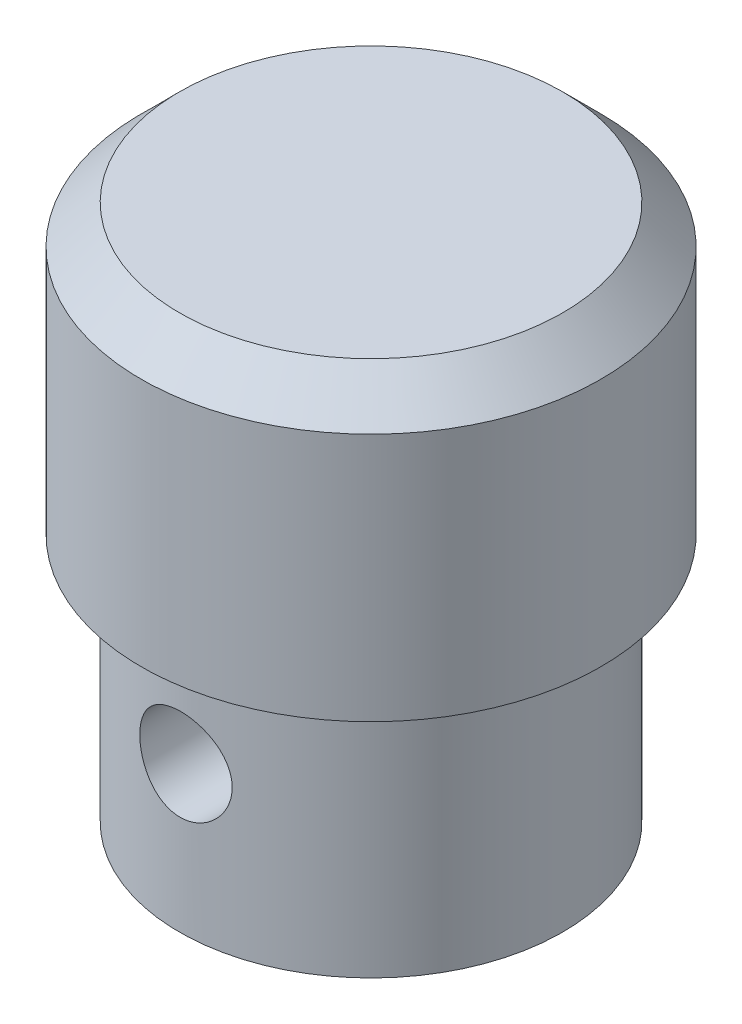
from build123d import *

# Parameters (mm, degrees)
SMUSSO1_SIZE              = 1
SCHIZZO2_R                = 1.5
TAGLIO_ESTRUSIONE1_DEPTH  = 10
FORO_PER_VITE_M2_2_REACH  = 18.162
FORO_PER_VITE_M2_2_BORE_R = 1.2


with BuildPart() as part:
    # Schizzo1 → Rivoluzione1 (revolve)
    with BuildSketch(Plane.XY, mode=Mode.PRIVATE) as rivoluzione1_sk:
        Polygon((-6, 14), (-6, 6.5), (-5, 6.5), (-5, 0), (0, 0), (0, 14), align=None)
    revolve(rivoluzione1_sk.sketch.rotate(Axis((0, 0, 0), (0, 1, 0)), 270), axis=Axis((0, 0, 0), (0, 1, 0)))

    # Smusso1
    smusso1_edges = [part.edges().sort_by_distance(p)[0] for p in [
        (0, 14, 6),
    ]]
    chamfer(smusso1_edges, length=SMUSSO1_SIZE)

    # Schizzo2 → Taglio-Estrusione1 (cut)
    with BuildSketch(Plane(origin=(0, 0, 0), x_dir=(-1, 0, 0), z_dir=(0, -1, 0))):
        with Locations(Location((0, 0, 0), (0, 0, 90))):
            Circle(SCHIZZO2_R)
    extrude(amount=-TAGLIO_ESTRUSIONE1_DEPTH, mode=Mode.SUBTRACT)

    # Foro per Vite M2-2 bore (on position points) → Foro per Vite M2-2 (cut, up to next)
    with BuildSketch(Plane(origin=(0.02357444, 3.80568373, 4.999944424), x_dir=(0.999988884854, 0, -0.004714888012), z_dir=(0.004714888012, 0, 0.999988884854)), mode=Mode.PRIVATE) as foro_per_vite_m2_2_sk1:
        Circle(FORO_PER_VITE_M2_2_BORE_R)
    foro_per_vite_m2_2_tool1 = extrude(foro_per_vite_m2_2_sk1.sketch, amount=-FORO_PER_VITE_M2_2_REACH, mode=Mode.PRIVATE) & part.part
    add(foro_per_vite_m2_2_tool1.solids().sort_by_distance((0.023574, 3.805684, 4.999944))[0], mode=Mode.SUBTRACT)


solid = part.part
